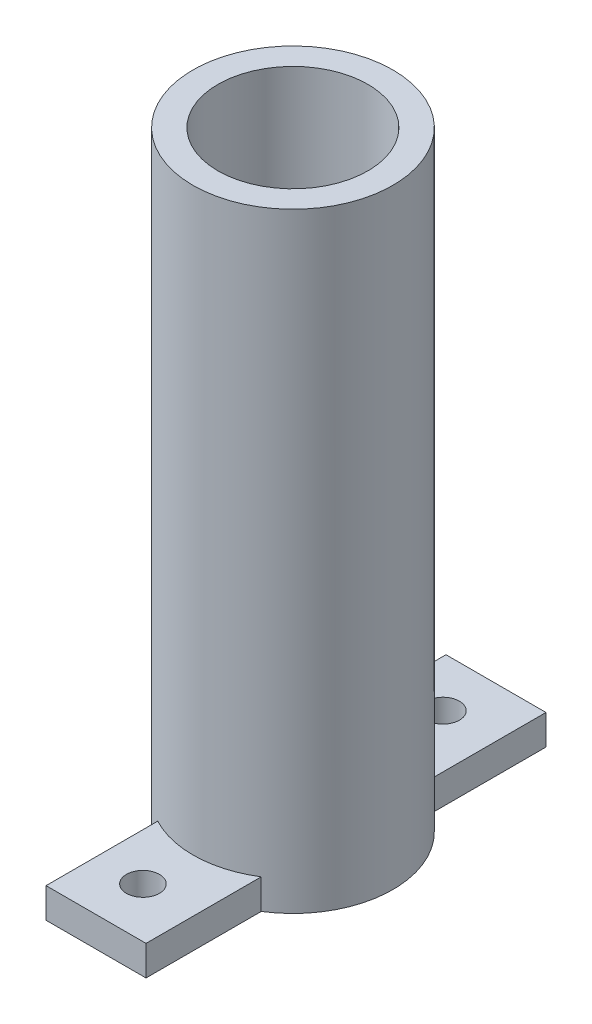
from build123d import *

# Parameters (mm, degrees)
ESQUISSE1_R        = 7.5
ESQUISSE1_R_2      = 1.65
BOSS_EXTRU_1_DEPTH = 3
BOSS_EXTRU_2_START = 58
ESQUISSE2_R        = 10
ESQUISSE2_R_2      = 7.5
BOSS_EXTRU_2_DEPTH = 58


with BuildPart() as part:
    # Esquisse1 → Boss.-Extru.1 (new body)
    with BuildSketch(Plane(origin=(0, 0, 0), x_dir=(1, 0, 0), z_dir=(0, 1, 0))):
        with BuildLine():
            Line((0, 20), (5.307172847, 20))
            Line((5.307172847, 20), (5.307172847, 8.475489152))
            ThreePointArc((5.307172847, 8.475489152), (10, 0), (5.307172847, -8.475489152))
            Line((5.307172847, -8.475489152), (5.307172847, -20))
            Line((5.307172847, -20), (0, -20))
            Line((0, -20), (-4.692827153, -20))
            Line((-4.692827153, -20), (-4.692827153, -8.830479789))
            ThreePointArc((-4.692827153, -8.830479789), (-10, 0), (-4.692827153, 8.830479789))
            Line((-4.692827153, 8.830479789), (-4.692827153, 20))
            Line((-4.692827153, 20), (0, 20))
        make_face()
        with Locations(Location((0, 0, 0), (0, 0, 270))):
            Circle(ESQUISSE1_R, mode=Mode.SUBTRACT)
        with Locations(Location((0, 15, 0), (0, 0, 270))):
            Circle(ESQUISSE1_R_2, mode=Mode.SUBTRACT)
        with Locations(Location((0, -15, 0), (0, 0, 270))):
            Circle(ESQUISSE1_R_2, mode=Mode.SUBTRACT)
    extrude(amount=-BOSS_EXTRU_1_DEPTH)

    # Esquisse2 → Boss.-Extru.2 (add)
    with BuildSketch(Plane(origin=(0, 0, 0), x_dir=(1, 0, 0), z_dir=(0, 1, 0)).offset(BOSS_EXTRU_2_START)):
        with Locations(Location((0, 0, 0), (0, 0, 270))):
            Circle(ESQUISSE2_R)
        with Locations(Location((0, 0, 0), (0, 0, 270))):
            Circle(ESQUISSE2_R_2, mode=Mode.SUBTRACT)
    extrude(amount=-BOSS_EXTRU_2_DEPTH)


solid = part.part
